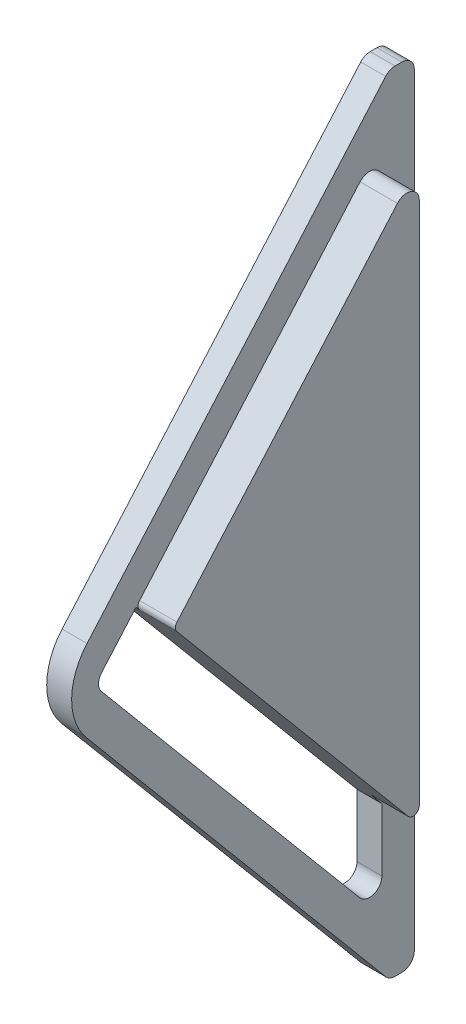
from build123d import *

# Parameters (mm, degrees)
BOSS_EXTRUDE1_DEPTH = 5
BOSS_EXTRUDE2_START = -5
BOSS_EXTRUDE2_DEPTH = 2
FILLET1_R           = 5
FILLET2_R           = 1
FILLET3_R           = 1
CUT_EXTRUDE1_DEPTH  = 63.739091162
FILLET4_R           = 0.5


with BuildPart() as part:
    # Sketch32 → Boss-Extrude1 (new body)
    with BuildSketch(Plane(origin=(0, 0, 0), x_dir=(0, 0, -1), z_dir=(1, 0, 0))):
        Polygon((-23.663373299, 32.245792092), (-0.6, 4.759934105), (-0.6, 58.641752364), align=None)
    extrude(amount=-BOSS_EXTRUDE1_DEPTH)

    # Sketch33 → Boss-Extrude2 (add)
    with BuildSketch(Plane(origin=(0, 0, 0), x_dir=(0, 0, -1), z_dir=(1, 0, 0)).offset(BOSS_EXTRUDE2_START)):
        Polygon((0, 0), (2, 0), (2, 63.28), (0, 63.28), (-27.086136094, 32.28), align=None)
    extrude(amount=BOSS_EXTRUDE2_DEPTH)

    # Fillet1
    fillet1_edges = [part.edges().sort_by_distance(p)[0] for p in [
        (-4, 32.28, 27.086136094),
    ]]
    fillet(fillet1_edges, radius=FILLET1_R)

    # Fillet2
    fillet2_edges = [part.edges().sort_by_distance(p)[0] for p in [
        (-1.5, 4.759934105, 0.6),
        (-1.5, 58.641752364, 0.6),
        (-1.5, 32.245792092, 23.663373299),
    ]]
    fillet(fillet2_edges, radius=FILLET2_R)

    # Fillet3
    fillet3_edges = [part.edges().sort_by_distance(p)[0] for p in [
        (-4, 63.28, -2),
        (-4, 63.28, 0),
        (-4, 0, 0),
        (-4, 0, -2),
    ]]
    fillet(fillet3_edges, radius=FILLET3_R)


with BuildPart() as part_1:
    # Body-Move/Copy1: moved
    add(part.part.moved(Location((20.819939299, -2.965088501, -8.971960843))))

    # Sketch34 → Cut-Extrude1 (cut, through all)
    with BuildSketch(Plane.ZY.offset(-15.819939299)):
        with BuildLine():
            Line((14.128009591, 29.925516449), (11.361881222, 33.091341915))
            Line((11.361881222, 33.091341915), (-8.371960843, 9.573464739))
            Line((-8.371960843, 9.573464739), (-8.371960843, 4.542323024))
            ThreePointArc((-8.371960843, 4.542323024), (-7.713980986, 3.602630403), (-6.6059164, 3.899535414))
            Line((-6.6059164, 3.899535414), (13.428952617, 27.776162543))
            Line((13.428952617, 27.776162543), (14.14100967, 28.624759093))
            ThreePointArc((14.14100967, 28.624759093), (14.374915288, 29.277540443), (14.128009591, 29.925516449))
        make_face()
    extrude(amount=-CUT_EXTRUDE1_DEPTH, mode=Mode.SUBTRACT)

    # Fillet4
    fillet4_edges = [part_1.edges().sort_by_distance(p)[0] for p in [
        (19.319939299, 33.091341915, 11.361881222),
        (19.319939299, 9.573464739, -8.371960843),
    ]]
    fillet(fillet4_edges, radius=FILLET4_R)


solid = part_1.part
